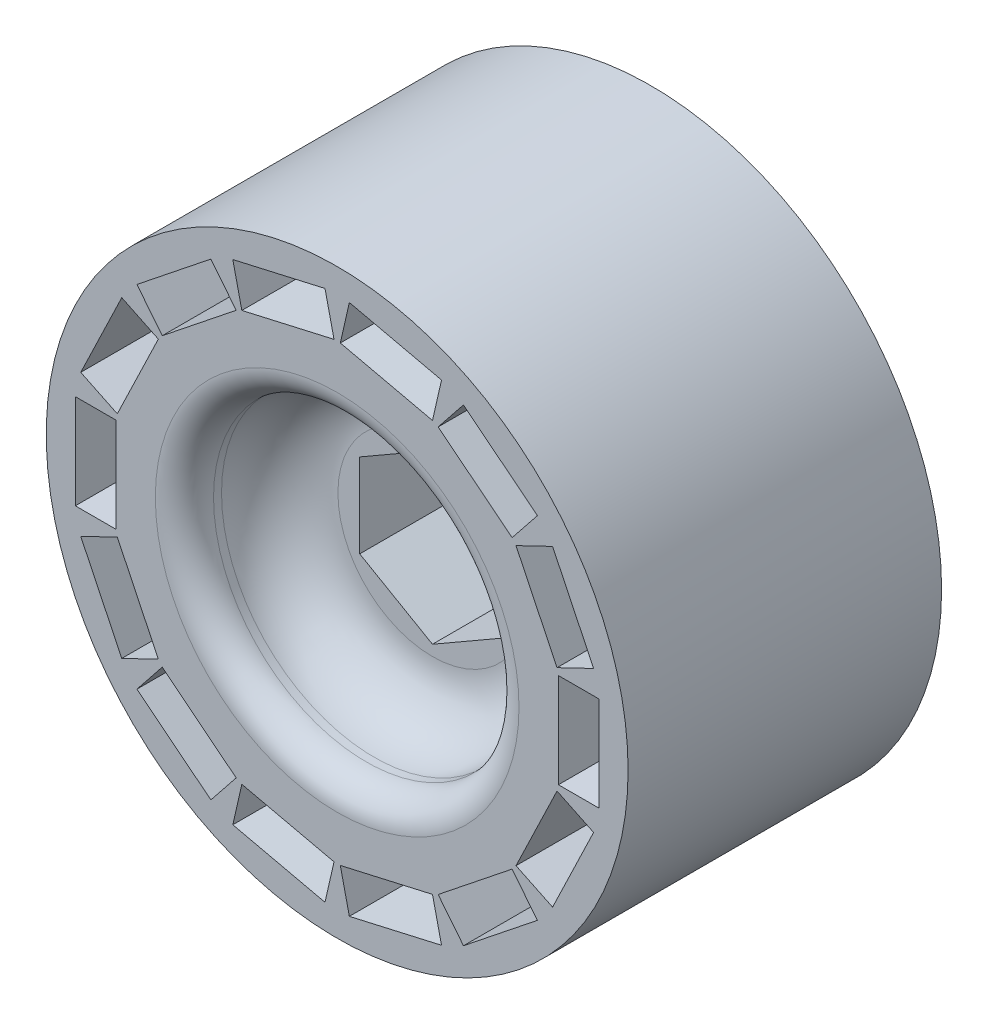
from build123d import *

# Parameters (mm, degrees)
SKETCH1_R                       = 20
SKETCH1_R_2                     = 1
BOSS_EXTRUDE1_DEPTH             = 21.55
TAP_DRILL_FOR_M5X0_8_TAP1_D     = 4.2
TAP_DRILL_FOR_M5X0_8_TAP1_DEPTH = 5
TAP_DRILL_FOR_M5X0_8_TAP1_TIP   = 1.2618073
SKETCH4_W                       = 2.79
SKETCH4_H                       = 6.5
CUT_EXTRUDE1_DEPTH              = 19.05
CIRPATTERN1_COUNT               = 14
SKETCH5_R                       = 6
SKETCH5_R_2                     = 5
SKETCH5_R_3                     = 1
CUT_EXTRUDE2_DEPTH              = 1
CUT_EXTRUDE3_DEPTH              = 21.55
SKETCH7_R                       = 10.5
CUT_EXTRUDE4_DEPTH              = 6.55
FILLET4_R                       = 2
FILLET5_R                       = 4


with BuildPart() as part:
    # Sketch1 → Boss-Extrude1 (new body)
    with BuildSketch(Plane.XY):
        with Locations((-11.822558412, 14.529752947)):
            Circle(SKETCH1_R)
        with Locations((-11.822558412, 14.529752947)):
            Circle(SKETCH1_R_2, mode=Mode.SUBTRACT)
    extrude(amount=BOSS_EXTRUDE1_DEPTH)

    # Tap Drill for M5x0.8 Tap1
    with Locations(Plane.XY.offset(21.55)):
        with Locations((-11.822558412, 14.529752947)):
            Hole(TAP_DRILL_FOR_M5X0_8_TAP1_D / 2, depth=TAP_DRILL_FOR_M5X0_8_TAP1_DEPTH)
            with Locations((0, 0, -(TAP_DRILL_FOR_M5X0_8_TAP1_DEPTH + TAP_DRILL_FOR_M5X0_8_TAP1_TIP / 2))):  # 118° drill point
                Cone(0, TAP_DRILL_FOR_M5X0_8_TAP1_D / 2, TAP_DRILL_FOR_M5X0_8_TAP1_TIP, mode=Mode.SUBTRACT)

    # Sketch4 → Cut-Extrude1 (cut)
    with BuildSketch(Plane.XY.offset(21.55)):
        with Locations((4.782441588, 14.529752947)):
            Rectangle(SKETCH4_W, SKETCH4_H)
    cut_extrude1 = extrude(amount=-CUT_EXTRUDE1_DEPTH, mode=Mode.SUBTRACT)

    # CirPattern1: Cut-Extrude1 ×14 about axis
    cirpattern1_axis = Axis((-11.822558412, 14.529752947, 0), (0, 0, 1))
    for i in range(1, CIRPATTERN1_COUNT):
        add(cut_extrude1.rotate(cirpattern1_axis, i * 360 / CIRPATTERN1_COUNT), mode=Mode.SUBTRACT)

    # Sketch5 → Cut-Extrude2 (cut)
    # profile 1 of 2: a face of its own
    with BuildSketch(Plane(origin=(0, 0, 0), x_dir=(-1, 0, 0), z_dir=(0, 0, -1))):
        with Locations((11.822558412, 14.529752947)):
            Circle(SKETCH5_R)
        with Locations((11.822558412, 14.529752947)):
            Circle(SKETCH5_R_2, mode=Mode.SUBTRACT)
    # profile 2 of 2: a face of its own
    with BuildSketch(Plane(origin=(0, 0, 0), x_dir=(-1, 0, 0), z_dir=(0, 0, -1))):
        with Locations((11.822558412, 14.529752947)):
            Circle(SKETCH5_R_2)
        with Locations((11.822558412, 14.529752947)):
            Circle(SKETCH5_R_3, mode=Mode.SUBTRACT)
    extrude(amount=-CUT_EXTRUDE2_DEPTH, mode=Mode.SUBTRACT)

    # Sketch6 → Cut-Extrude3 (cut)
    with BuildSketch(Plane.XY.offset(21.55)):
        Polygon((-16.822558412, 17.416002947), (-11.822558412, 20.295742519), (-6.822558412, 17.416002947), (-6.822558412, 11.643502947), (-11.822558412, 8.763763375), (-16.822558412, 11.643502947), align=None)
    extrude(amount=-CUT_EXTRUDE3_DEPTH, mode=Mode.SUBTRACT)

    # Sketch7 → Cut-Extrude4 (cut)
    with BuildSketch(Plane.XY.offset(21.55)):
        with Locations((-11.822558412, 14.529752947)):
            Circle(SKETCH7_R)
    extrude(amount=-CUT_EXTRUDE4_DEPTH, mode=Mode.SUBTRACT)

    # Fillet4
    fillet4_edges = [part.edges().sort_by_distance(p)[0] for p in [
        (-22.322558412, 14.529752947, 21.55),
    ]]
    fillet(fillet4_edges, radius=FILLET4_R)

    # Fillet5
    fillet5_edges = [part.edges().sort_by_distance(p)[0] for p in [
        (-22.322558412, 14.529752947, 15),
    ]]
    fillet(fillet5_edges, radius=FILLET5_R)


solid = part.part
